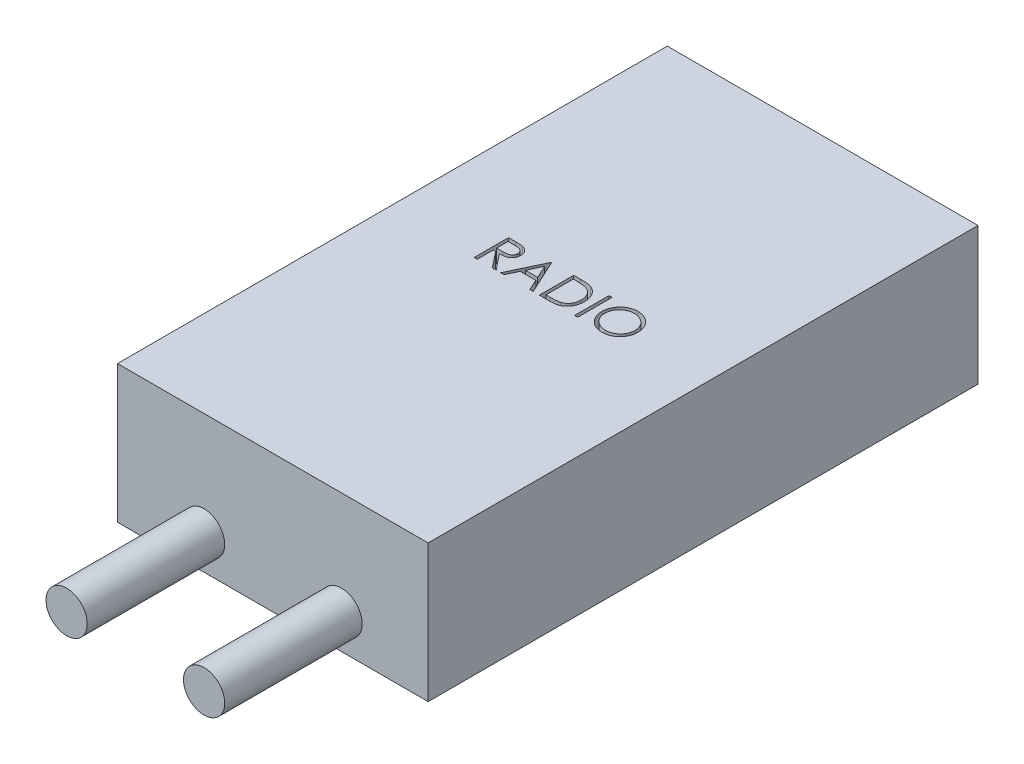
from build123d import *

# Parameters (mm, degrees)
SKETCH1_W           = 28.702
SKETCH1_H           = 50.8
BOSS_EXTRUDE1_DEPTH = 12.7
SKETCH2_R           = 1.905
BOSS_EXTRUDE2_DEPTH = 12.7
SKETCH3_W           = 0.284935897
SKETCH3_H           = 3.175
CUT_EXTRUDE1_DEPTH  = 1.27


with BuildPart() as part:
    # Sketch1 → Boss-Extrude1 (new body)
    with BuildSketch(Plane(origin=(0, 0, 0), x_dir=(1, 0, 0), z_dir=(0, 1, 0))):
        Rectangle(SKETCH1_W, SKETCH1_H)
    extrude(amount=BOSS_EXTRUDE1_DEPTH)

    # Sketch2 → Boss-Extrude2 (add)
    with BuildSketch(Plane.XY.offset(25.4)):
        with Locations(Location((-6.35, 3.175, 0), (0, 0, 180))):
            Circle(SKETCH2_R)
        with Locations(Location((6.35, 3.175, 0), (0, 0, 180))):
            Circle(SKETCH2_R)
    extrude(amount=BOSS_EXTRUDE2_DEPTH)

    # Sketch3 → Cut-Extrude1 (cut)
    # profile 1 of 5: a face of its own
    with BuildSketch(Plane(origin=(0, 12.7, 0), x_dir=(1, 0, 0), z_dir=(0, 1, 0))):
        with BuildLine():
            Line((-6.362474598, 2.738153854), (-5.727092987, 2.738153854))
            add(Edge.make_bspline(
                [(-5.727092987, 2.738153854), (-5.684692106, 2.738012716), (-5.603277718, 2.737741714), (-5.486643394, 2.736230629), (-5.380664528, 2.731899606), (-5.285396531, 2.728172534), (-5.200841151, 2.721376273), (-5.126739108, 2.714880543), (-5.063431697, 2.706377294), (-5.025108675, 2.698480231), (-5.00775705, 2.694904656)],
                knots=[0, 0, 0, 0, 1.410062039, 2.707475311, 3.878576406, 4.937260626, 5.877586885, 6.699081471, 7.410979367, 8, 8, 8, 8], degree=3))
            add(Edge.make_bspline(
                [(-5.00775705, 2.694904656), (-4.984528183, 2.689165376), (-4.938565986, 2.67780925), (-4.872389855, 2.653806612), (-4.809330432, 2.626030238), (-4.749649663, 2.593406006), (-4.693646481, 2.555691742), (-4.640743442, 2.513538517), (-4.590700486, 2.46717698), (-4.545541436, 2.415438231), (-4.50296101, 2.361157969), (-4.46704847, 2.302462418), (-4.436090878, 2.241083746), (-4.411443338, 2.176397732), (-4.39159689, 2.109031696), (-4.377603087, 2.03837543), (-4.369210939, 1.964750831), (-4.368356541, 1.9145333), (-4.367923316, 1.889070321)],
                knots=[0, 0, 0, 0, 1.027469482, 2.033020251, 3.019912614, 3.986113645, 4.951240523, 5.91722682, 6.890402269, 7.87763091, 8.8651537, 9.85103654, 10.82876324, 11.815024772, 12.821070561, 13.842952187, 14.906261191, 16, 16, 16, 16], degree=3))
            add(Edge.make_bspline(
                [(-4.367923316, 1.889070321), (-4.369255907, 1.846765619), (-4.371856137, 1.764218188), (-4.396099624, 1.644420103), (-4.435811181, 1.532669796), (-4.490533022, 1.429107974), (-4.560219261, 1.335753317), (-4.643971036, 1.253756261), (-4.741835069, 1.185140055), (-4.832938805, 1.137557868), (-4.913415258, 1.107084301), (-4.979666906, 1.085642747), (-5.051936236, 1.069076535), (-5.129530818, 1.054235559), (-5.212773562, 1.043030807), (-5.301464955, 1.034824254), (-5.39566825, 1.029695224), (-5.460382977, 1.028931405), (-5.493674518, 1.02853847)],
                knots=[0, 0, 0, 0, 1.260483769, 2.459530307, 3.627416485, 4.787058657, 5.939039949, 7.08810263, 8.267026773, 9.491475466, 10.141966685, 10.831826277, 11.566392101, 12.351337768, 13.187381173, 14.07005841, 15.007169909, 16, 16, 16, 16], degree=3))
            Line((-5.493674518, 1.02853847), (-4.327218187, -0.436846146))
            Line((-4.327218187, -0.436846146), (-4.679571954, -0.436846146))
            Line((-4.679571954, -0.436846146), (-5.846028284, 1.02853847))
            Line((-5.846028284, 1.02853847), (-6.0775387, 1.02853847))
            Line((-6.0775387, 1.02853847), (-6.0775387, -0.436846146))
            Line((-6.0775387, -0.436846146), (-6.362474598, -0.436846146))
            Line((-6.362474598, -0.436846146), (-6.362474598, 2.738153854))
        make_face()
        with BuildLine():
            Line((-6.0775387, 2.412512829), (-6.0775387, 1.354179495))
            Line((-6.0775387, 1.354179495), (-5.496218588, 1.349727372))
            add(Edge.make_bspline(
                [(-5.496218588, 1.349727372), (-5.469076839, 1.349715364), (-5.416468397, 1.34969209), (-5.340358509, 1.353315016), (-5.269492407, 1.357436455), (-5.204141154, 1.363740504), (-5.144275553, 1.37186494), (-5.089925528, 1.382027648), (-5.04100236, 1.393867733), (-4.9839444, 1.412193493), (-4.920229832, 1.441227524), (-4.850986294, 1.483469084), (-4.792019887, 1.536599642), (-4.742201541, 1.597354134), (-4.702169842, 1.664152731), (-4.673946764, 1.736194723), (-4.656037549, 1.811661387), (-4.653925225, 1.863530099), (-4.652859213, 1.889706338)],
                knots=[0, 0, 0, 0, 1.146690395, 2.22261258, 3.21895312, 4.145990853, 4.996080663, 5.770904154, 6.481378293, 7.121626537, 8.300444488, 9.431385265, 10.535395872, 11.636531494, 12.74115979, 13.810798291, 14.895190096, 16, 16, 16, 16], degree=3))
            add(Edge.make_bspline(
                [(-4.652859213, 1.889706338), (-4.653949709, 1.915239302), (-4.656110673, 1.965836318), (-4.673753484, 2.039909894), (-4.703588852, 2.109820627), (-4.743795453, 2.175284124), (-4.792780401, 2.234707185), (-4.850218703, 2.285549959), (-4.914539844, 2.327504831), (-4.974657288, 2.354314876), (-5.028391181, 2.370752171), (-5.07504523, 2.382319299), (-5.127760642, 2.391612495), (-5.186793379, 2.399058379), (-5.25189143, 2.405458222), (-5.323383949, 2.409768764), (-5.4007966, 2.41232134), (-5.454451316, 2.412447514), (-5.4822262, 2.412512829)],
                knots=[0, 0, 0, 0, 1.101028733, 2.181837193, 3.264309656, 4.369019818, 5.486613113, 6.575447106, 7.666700264, 8.788928104, 9.402425223, 10.0903467, 10.862060571, 11.710948788, 12.657782767, 13.684531032, 14.801375019, 16, 16, 16, 16], degree=3))
            Line((-5.4822262, 2.412512829), (-6.0775387, 2.412512829))
        make_face(mode=Mode.SUBTRACT)
    # profile 2 of 5: a face of its own
    with BuildSketch(Plane(origin=(0, 12.7, 0), x_dir=(1, 0, 0), z_dir=(0, 1, 0))):
        Polygon((-2.373372034, 2.738153854), (-0.907987418, -0.436846146), (-1.217728003, -0.436846146), (-1.687109013, 0.58078206), (-3.126416905, 0.58078206), (-3.609154285, -0.436846146), (-3.920166905, -0.436846146), (-2.414077162, 2.738153854), align=None)
        Polygon((-2.396904686, 2.119308702), (-2.971864622, 0.906423085), (-1.837209173, 0.906423085), align=None, mode=Mode.SUBTRACT)
    # profile 3 of 5: a face of its own
    with BuildSketch(Plane(origin=(0, 12.7, 0), x_dir=(1, 0, 0), z_dir=(0, 1, 0))):
        with BuildLine():
            Line((-0.338115623, -0.436846146), (-0.338115623, 2.738153854))
            Line((-0.338115623, 2.738153854), (0.302990146, 2.738153854))
            add(Edge.make_bspline(
                [(0.302990146, 2.738153854), (0.358751299, 2.73775238), (0.466481558, 2.736976734), (0.622158564, 2.732058758), (0.76619812, 2.723358835), (0.898126499, 2.710686479), (1.018305884, 2.695126227), (1.126399765, 2.675622289), (1.222967066, 2.652591592), (1.282357201, 2.632956076), (1.310442069, 2.623670681)],
                knots=[0, 0, 0, 0, 1.314313732, 2.53924729, 3.670748893, 4.714932338, 5.66265055, 6.526160246, 7.303039223, 8, 8, 8, 8], degree=3))
            add(Edge.make_bspline(
                [(1.310442069, 2.623670681), (1.347176582, 2.609672827), (1.419812593, 2.581994543), (1.523233339, 2.529782755), (1.620592776, 2.470625156), (1.712413, 2.404443766), (1.796596607, 2.329364679), (1.876432342, 2.24857718), (1.94865427, 2.159143471), (2.01479251, 2.062918303), (2.074424144, 1.961035227), (2.126257523, 1.853688379), (2.169305074, 1.741422911), (2.205040358, 1.624551027), (2.23320393, 1.502815742), (2.252418968, 1.376075306), (2.265092652, 1.244830613), (2.266366327, 1.155772349), (2.267012582, 1.110584744)],
                knots=[0, 0, 0, 0, 0.984719456, 1.947108742, 2.898477687, 3.838006223, 4.779231079, 5.722358779, 6.681677486, 7.655904652, 8.64651281, 9.637519902, 10.640069247, 11.656948941, 12.698408672, 13.768548281, 14.867775369, 16, 16, 16, 16], degree=3))
            add(Edge.make_bspline(
                [(2.267012582, 1.110584744), (2.266442018, 1.07134062), (2.265317664, 0.994005976), (2.255221784, 0.880031735), (2.240547551, 0.76943871), (2.217828886, 0.662753539), (2.190249463, 0.559041513), (2.154903412, 0.459407977), (2.11441264, 0.36293895), (2.067195964, 0.270938811), (2.015360565, 0.183777466), (1.959732984, 0.101612523), (1.900372553, 0.025616428), (1.836713229, -0.044440955), (1.769577658, -0.108454016), (1.698526301, -0.166957487), (1.623375819, -0.218806647), (1.544462806, -0.266038953), (1.459485174, -0.307241704), (1.366833353, -0.342103213), (1.266112213, -0.370992642), (1.157568981, -0.395096241), (1.041016112, -0.414216365), (0.916339335, -0.427031021), (0.783730208, -0.435696896), (0.692671875, -0.436455624), (0.645803647, -0.436846146)],
                knots=[0, 0, 0, 0, 1.105936401, 2.179363191, 3.223086493, 4.248585256, 5.251745608, 6.245858792, 7.225916811, 8.198733463, 9.158002045, 10.082870192, 10.993790845, 11.873723703, 12.748670949, 13.606408763, 14.465103618, 15.319838547, 16.196477973, 17.123216899, 18.106603292, 19.147568657, 20.255746949, 21.433717677, 22.679120308, 24, 24, 24, 24], degree=3))
            Line((0.645803647, -0.436846146), (-0.338115623, -0.436846146))
        make_face()
        with BuildLine():
            Line((-0.053179726, -0.11120512), (0.311258375, -0.11120512))
            add(Edge.make_bspline(
                [(0.311258375, -0.11120512), (0.363626254, -0.110980061), (0.464348864, -0.110547191), (0.609181476, -0.106748799), (0.741514929, -0.100542184), (0.861368012, -0.091856221), (0.968673056, -0.080363977), (1.063654314, -0.067550673), (1.146000442, -0.051587271), (1.195829288, -0.037117472), (1.21885553, -0.030430881)],
                knots=[0, 0, 0, 0, 1.375205317, 2.645023457, 3.804390687, 4.853969522, 5.800190428, 6.637939096, 7.370582563, 8, 8, 8, 8], degree=3))
            add(Edge.make_bspline(
                [(1.21885553, -0.030430881), (1.247837259, -0.020224111), (1.305108488, -5.4358e-05), (1.387550615, 0.036737235), (1.464437327, 0.080318255), (1.537108564, 0.128761747), (1.604533458, 0.183776334), (1.66751105, 0.244165731), (1.725914541, 0.310237277), (1.77914052, 0.381908967), (1.826773053, 0.45873471), (1.868021954, 0.539959223), (1.904172986, 0.624692544), (1.932547138, 0.714235852), (1.954786275, 0.807788641), (1.970538528, 0.905357492), (1.980349028, 1.006924183), (1.981493341, 1.076005039), (1.982076684, 1.111220761)],
                knots=[0, 0, 0, 0, 0.998632004, 1.973411704, 2.929992603, 3.868527914, 4.809262121, 5.754881198, 6.702106254, 7.672490631, 8.653608572, 9.636854334, 10.631411391, 11.644891563, 12.686317036, 13.754757253, 14.855430412, 16, 16, 16, 16], degree=3))
            add(Edge.make_bspline(
                [(1.982076684, 1.111220761), (1.981611059, 1.148353276), (1.980696335, 1.221300429), (1.969198925, 1.328334845), (1.952397228, 1.431278007), (1.928100599, 1.530136798), (1.897139016, 1.625104089), (1.858499591, 1.715654645), (1.814352015, 1.802744776), (1.761825416, 1.884364379), (1.704298414, 1.961555985), (1.640455623, 2.03227223), (1.571311345, 2.096674202), (1.497619732, 2.155764865), (1.417303935, 2.207166913), (1.332255944, 2.253146974), (1.241228085, 2.292168533), (1.177897996, 2.31292293), (1.145713503, 2.323470361)],
                knots=[0, 0, 0, 0, 1.122418816, 2.205001699, 3.251619955, 4.274784885, 5.280384055, 6.268708349, 7.249350384, 8.229342522, 9.199999885, 10.157847722, 11.105861043, 12.055065948, 13.010012805, 13.98527497, 14.976112212, 16, 16, 16, 16], degree=3))
            add(Edge.make_bspline(
                [(1.145713503, 2.323470361), (1.11908782, 2.33083312), (1.062474314, 2.346488367), (0.970091371, 2.36356567), (0.866119057, 2.378628322), (0.750095757, 2.391380972), (0.622153726, 2.400531614), (0.482194566, 2.407399878), (0.330157782, 2.412032323), (0.224763626, 2.41234865), (0.170062462, 2.412512829)],
                knots=[0, 0, 0, 0, 0.674548936, 1.434276114, 2.292660221, 3.240891867, 4.284742987, 5.42552168, 6.663806718, 8, 8, 8, 8], degree=3))
            Line((0.170062462, 2.412512829), (-0.053179726, 2.412512829))
            Line((-0.053179726, 2.412512829), (-0.053179726, -0.11120512))
        make_face(mode=Mode.SUBTRACT)
    # profile 4 of 5: a face of its own
    with BuildSketch(Plane(origin=(0, 12.7, 0), x_dir=(1, 0, 0), z_dir=(0, 1, 0))):
        with Locations((3.060762582, 1.150653854)):
            Rectangle(SKETCH3_W, SKETCH3_H)
    # profile 5 of 5: a face of its own
    with BuildSketch(Plane(origin=(0, 12.7, 0), x_dir=(1, 0, 0), z_dir=(0, 1, 0))):
        with BuildLine():
            add(Edge.make_bspline(
                [(5.503070274, 2.819564111), (5.561860484, 2.818075055), (5.677329308, 2.815150425), (5.847032965, 2.792762953), (6.00904423, 2.754032135), (6.164682856, 2.702449286), (6.312087199, 2.633638522), (6.452366766, 2.550466995), (6.585187787, 2.45206335), (6.70876004, 2.339188266), (6.821841702, 2.216376133), (6.921469471, 2.085314028), (7.00496498, 1.946794401), (7.073532087, 1.801233504), (7.127324397, 1.648960533), (7.164443815, 1.489163688), (7.188154852, 1.322878333), (7.190926878, 1.209461106), (7.192333095, 1.15192589)],
                knots=[0, 0, 0, 0, 1.065120563, 2.091984664, 3.0946048, 4.079830382, 5.057816894, 6.036188127, 7.030412546, 8.04752943, 9.064399622, 10.05169764, 11.02544977, 11.989514704, 12.962713494, 13.945757189, 14.957906945, 16, 16, 16, 16], degree=3))
            add(Edge.make_bspline(
                [(7.192333095, 1.15192589), (7.190927084, 1.094814492), (7.188155675, 0.98224131), (7.164416856, 0.817011186), (7.127186806, 0.658178911), (7.074031621, 0.506009641), (7.005791366, 0.360342851), (6.921739889, 0.221561828), (6.82273322, 0.089621076), (6.710059862, -0.034033984), (6.587231774, -0.147424547), (6.455487175, -0.246229527), (6.317788949, -0.331250697), (6.172365142, -0.399090173), (6.021144394, -0.453311844), (5.862773287, -0.490280301), (5.697993913, -0.514126404), (5.585625217, -0.51686463), (5.528510979, -0.518256402)],
                knots=[0, 0, 0, 0, 1.043624062, 2.057103931, 3.04512605, 4.022047818, 4.998200453, 5.980619268, 6.982898556, 8.009068085, 9.034988726, 10.034168286, 11.015286542, 11.987931943, 12.962482838, 13.94673481, 14.956375938, 16, 16, 16, 16], degree=3))
            add(Edge.make_bspline(
                [(5.528510979, -0.518256402), (5.470976061, -0.516850887), (5.357559423, -0.514080242), (5.191065112, -0.490329968), (5.031156016, -0.453190357), (4.878289426, -0.400113939), (4.732380097, -0.331518309), (4.593142664, -0.247875765), (4.461136009, -0.148627858), (4.337454568, -0.035991037), (4.224289224, 0.086628871), (4.125628933, 0.218014231), (4.04196758, 0.355587395), (3.973602272, 0.499730149), (3.919478083, 0.649745672), (3.882552998, 0.806634648), (3.858662528, 0.969502629), (3.855909488, 1.080394401), (3.854512582, 1.136661467)],
                knots=[0, 0, 0, 0, 1.053102029, 2.075944431, 3.073151272, 4.055350789, 5.033113405, 6.020478099, 7.024410459, 8.052272461, 9.079885166, 10.07527673, 11.055994387, 12.023226415, 12.992069828, 13.970394897, 14.97016774, 16, 16, 16, 16], degree=3))
            add(Edge.make_bspline(
                [(3.854512582, 1.136661467), (3.854997573, 1.174428245), (3.855961436, 1.249485357), (3.867565328, 1.360942916), (3.884403443, 1.470608012), (3.908535178, 1.578168801), (3.94009619, 1.68336198), (3.977336243, 1.786913029), (4.022820246, 1.88777255), (4.074237691, 1.986418341), (4.131625188, 2.081312656), (4.195012475, 2.171010563), (4.262173131, 2.256264753), (4.335799924, 2.334865964), (4.41346627, 2.409100781), (4.496432085, 2.477828388), (4.584191121, 2.541668522), (4.677120994, 2.599199832), (4.772931858, 2.651232761), (4.871698649, 2.695884011), (4.972079967, 2.734207224), (5.074545969, 2.765268544), (5.178824555, 2.789790463), (5.285143317, 2.806488562), (5.393417554, 2.818122051), (5.466362107, 2.819081356), (5.503070274, 2.819564111)],
                knots=[0, 0, 0, 0, 1.037015668, 2.060948919, 3.074880161, 4.083647147, 5.086022904, 6.090072063, 7.104153813, 8.122640571, 9.144368836, 10.147691507, 11.138137339, 12.123020368, 13.103399296, 14.087645067, 15.080126199, 16.082011238, 17.087798457, 18.072939717, 19.057185487, 20.037253025, 21.01195951, 21.997135196, 22.992090687, 24, 24, 24, 24], degree=3))
        make_face()
        with BuildLine():
            add(Edge.make_bspline(
                [(5.517062662, 2.493923085), (5.486932244, 2.493555792), (5.426959458, 2.492824717), (5.337801343, 2.483194746), (5.249815803, 2.469469775), (5.162984667, 2.449892253), (5.077671248, 2.423218576), (4.99308032, 2.392520038), (4.909983264, 2.35512662), (4.828654408, 2.312878524), (4.749810018, 2.266116289), (4.675412782, 2.214434758), (4.605270097, 2.159045926), (4.539553706, 2.099820531), (4.478456571, 2.036456963), (4.420776163, 1.969915825), (4.368824471, 1.898295181), (4.321212555, 1.823537169), (4.278606014, 1.745739163), (4.240718871, 1.665720217), (4.209727234, 1.582827601), (4.184452079, 1.497960615), (4.16349725, 1.41125367), (4.150222191, 1.322049007), (4.140486407, 1.230794869), (4.139797119, 1.169125616), (4.139448479, 1.137933502)],
                knots=[0, 0, 0, 0, 1.008559885, 2.007477868, 2.99961109, 3.989939068, 4.984837346, 5.991145699, 7.001802488, 8.033829008, 9.059044045, 10.069351652, 11.065060232, 12.050310815, 13.029377138, 14.011219647, 14.996725999, 15.989392538, 16.977580475, 17.965360261, 18.951710183, 19.937753436, 20.929683414, 21.935841486, 22.955955122, 24, 24, 24, 24], degree=3))
            add(Edge.make_bspline(
                [(4.139448479, 1.137933502), (4.140604961, 1.092066344), (4.142880119, 1.001831456), (4.162798772, 0.869598926), (4.193480134, 0.742518837), (4.238707888, 0.621286534), (4.295268803, 0.504859935), (4.365143196, 0.394271868), (4.447928224, 0.289492446), (4.541965851, 0.191253167), (4.644765735, 0.101585901), (4.753924712, 0.022879095), (4.868273341, -0.043714489), (4.988109818, -0.097966233), (5.112794371, -0.140955495), (5.243130436, -0.170418253), (5.378249781, -0.189808845), (5.47035259, -0.191670988), (5.517062662, -0.192615376)],
                knots=[0, 0, 0, 0, 1.032063989, 2.030389145, 3.003944642, 3.970395727, 4.937377036, 5.913328081, 6.909231446, 7.93887556, 8.970685674, 9.976071282, 10.964166581, 11.944589148, 12.933237628, 13.927779006, 14.949070134, 16, 16, 16, 16], degree=3))
            add(Edge.make_bspline(
                [(5.517062662, -0.192615376), (5.548458424, -0.192184026), (5.61072565, -0.191328529), (5.703340874, -0.182711872), (5.79428758, -0.16889439), (5.883438205, -0.149000153), (5.97069157, -0.124101615), (6.056411856, -0.094521748), (6.139686019, -0.057618085), (6.221564586, -0.016843871), (6.29993832, 0.029638272), (6.37475541, 0.079565736), (6.444130049, 0.134872985), (6.509797278, 0.193218429), (6.571145253, 0.255778491), (6.627759117, 0.322471835), (6.679448237, 0.393719431), (6.727042073, 0.468364049), (6.769499319, 0.546374936), (6.806491787, 0.626684001), (6.837875407, 0.709093493), (6.86321055, 0.793722275), (6.883063791, 0.880409617), (6.896743432, 0.969271588), (6.906312373, 1.06013042), (6.907033622, 1.121583775), (6.907397197, 1.152561907)],
                knots=[0, 0, 0, 0, 1.047197238, 2.076906641, 3.100256066, 4.114471768, 5.12198147, 6.126382909, 7.136867548, 8.15857795, 9.17633901, 10.174870724, 11.156907918, 12.133735059, 13.104061851, 14.077631395, 15.04955518, 16.038496417, 17.029181396, 18.010275684, 18.986308667, 19.968651475, 20.955262928, 21.950658345, 22.966943676, 24, 24, 24, 24], degree=3))
            add(Edge.make_bspline(
                [(6.907397197, 1.152561907), (6.90703333, 1.183328115), (6.906311534, 1.244358555), (6.896748003, 1.334583725), (6.883049338, 1.422806282), (6.863307453, 1.508679874), (6.837861956, 1.592226393), (6.806486307, 1.673367372), (6.769488214, 1.752405092), (6.727026467, 1.829144204), (6.679296399, 1.902781288), (6.627140907, 1.973177762), (6.569659484, 2.039011606), (6.508494447, 2.101908078), (6.442118001, 2.160525735), (6.37083082, 2.214884022), (6.295498341, 2.266294778), (6.215735777, 2.312672966), (6.133418048, 2.35550302), (6.048950386, 2.392197858), (5.963289703, 2.423378281), (5.876653829, 2.449972957), (5.788313556, 2.469393098), (5.698865797, 2.483207115), (5.608434305, 2.492821365), (5.547616527, 2.49355468), (5.517062662, 2.493923085)],
                knots=[0, 0, 0, 0, 1.02996197, 2.043119294, 3.035359645, 4.018872909, 4.991431989, 5.957985074, 6.929999688, 7.912076566, 8.892894881, 9.867085534, 10.843653904, 11.817741046, 12.803660682, 13.806313499, 14.818574707, 15.856120519, 16.894564902, 17.924820532, 18.937903209, 19.946497019, 20.957711757, 21.963978472, 22.977135795, 24, 24, 24, 24], degree=3))
        make_face(mode=Mode.SUBTRACT)
    extrude(amount=-CUT_EXTRUDE1_DEPTH, mode=Mode.SUBTRACT)


solid = part.part
